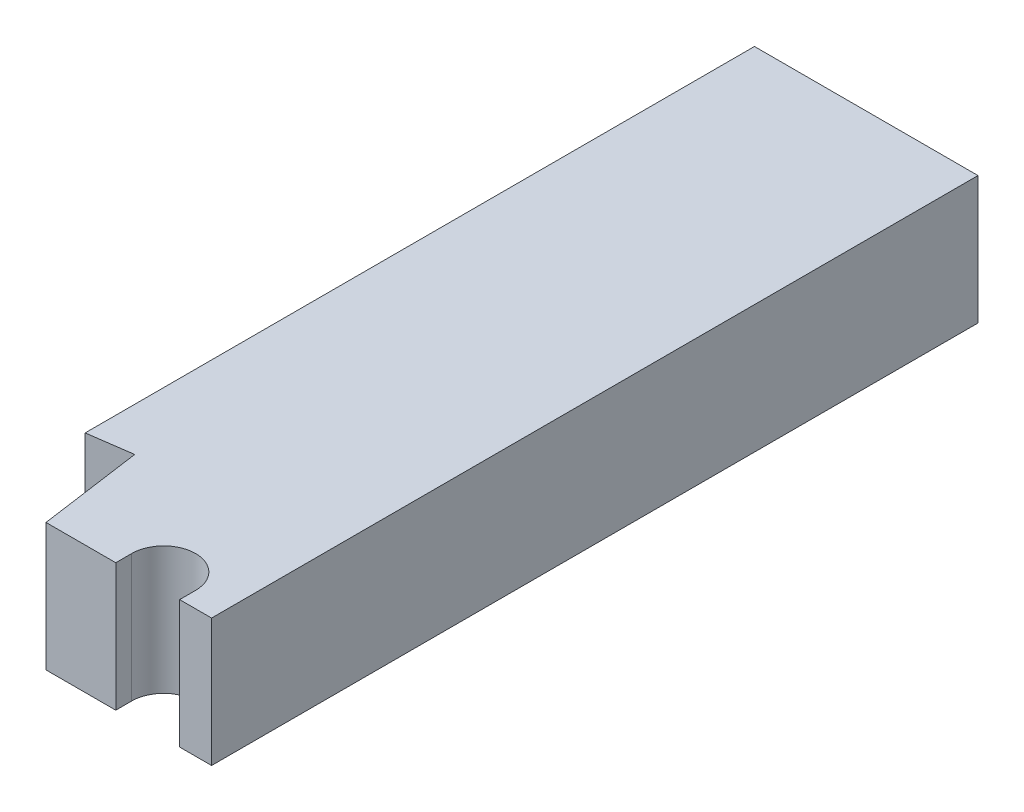
from build123d import *

# Parameters (mm, degrees)
SKETCH1_W               = 101.6
SKETCH1_H               = 50.8
BOSS_EXTRUDE1_DEPTH     = 304.8
CUT_EXTRUDE1_DEPTH      = 314.152231351
CUT_EXTRUDE1_DEPTH_BACK = 314.152231351
CUT_EXTRUDE2_DEPTH      = 314.152231351
CUT_EXTRUDE2_DEPTH_BACK = 314.152231351
SKETCH3_W               = 12.7
SKETCH3_H               = 304.8


with BuildPart() as part:
    # Sketch1 → Boss-Extrude1 (new body)
    with BuildSketch(Plane.XY):
        Rectangle(SKETCH1_W, SKETCH1_H)
    extrude(amount=BOSS_EXTRUDE1_DEPTH)

    # Sketch2 → Cut-Extrude1 (cut, two sides: drawn at the far end of the back side and taken through both)
    with BuildSketch(Plane(origin=(0, 25.4, 0), x_dir=(1, 0, 0), z_dir=(0, 1, 0)).offset(-CUT_EXTRUDE1_DEPTH_BACK)):
        with BuildLine():
            ThreePointArc((25.4, -298.45), (12.7, -285.75), (0, -298.45))
            ThreePointArc((0, -298.45), (0.432742006, -301.737001873), (1.701477372, -304.8))
            Line((1.701477372, -304.8), (23.698522628, -304.8))
            ThreePointArc((23.698522628, -304.8), (24.967257994, -301.737001873), (25.4, -298.45))
        make_face()
        with BuildLine():
            Line((23.698522628, -304.8), (1.701477372, -304.8))
            ThreePointArc((1.701477372, -304.8), (12.7, -311.15), (23.698522628, -304.8))
        make_face()
        with BuildLine():
            Line((25.4, -304.8), (25.4, -298.45))
            ThreePointArc((25.4, -298.45), (24.967257994, -301.737001873), (23.698522628, -304.8))
            Line((23.698522628, -304.8), (25.4, -304.8))
        make_face()
        with BuildLine():
            Line((0, -298.45), (0, -304.8))
            Line((0, -304.8), (1.701477372, -304.8))
            ThreePointArc((1.701477372, -304.8), (0.432742006, -301.737001873), (0, -298.45))
        make_face()
        Polygon((-31.75, -276.3266), (-50.8, -279.003902901), (-50.8, -304.8), (-27.748324597, -304.8), align=None)
        Polygon((-50.8, -266.17909273), (-50.8, -279.003902901), (-31.75, -276.3266), (-33.517498382, -263.750195527), align=None)
    extrude(amount=CUT_EXTRUDE1_DEPTH + CUT_EXTRUDE1_DEPTH_BACK, mode=Mode.SUBTRACT)

    # Sketch3 → Cut-Extrude2 (cut, two sides: drawn at the far end of the back side and taken through both)
    with BuildSketch(Plane(origin=(0, 25.4, 0), x_dir=(1, 0, 0), z_dir=(0, 1, 0)).offset(-CUT_EXTRUDE2_DEPTH_BACK)):
        with Locations((44.45, -152.4)):
            Rectangle(SKETCH3_W, SKETCH3_H)
    extrude(amount=CUT_EXTRUDE2_DEPTH + CUT_EXTRUDE2_DEPTH_BACK, mode=Mode.SUBTRACT)


solid = part.part
